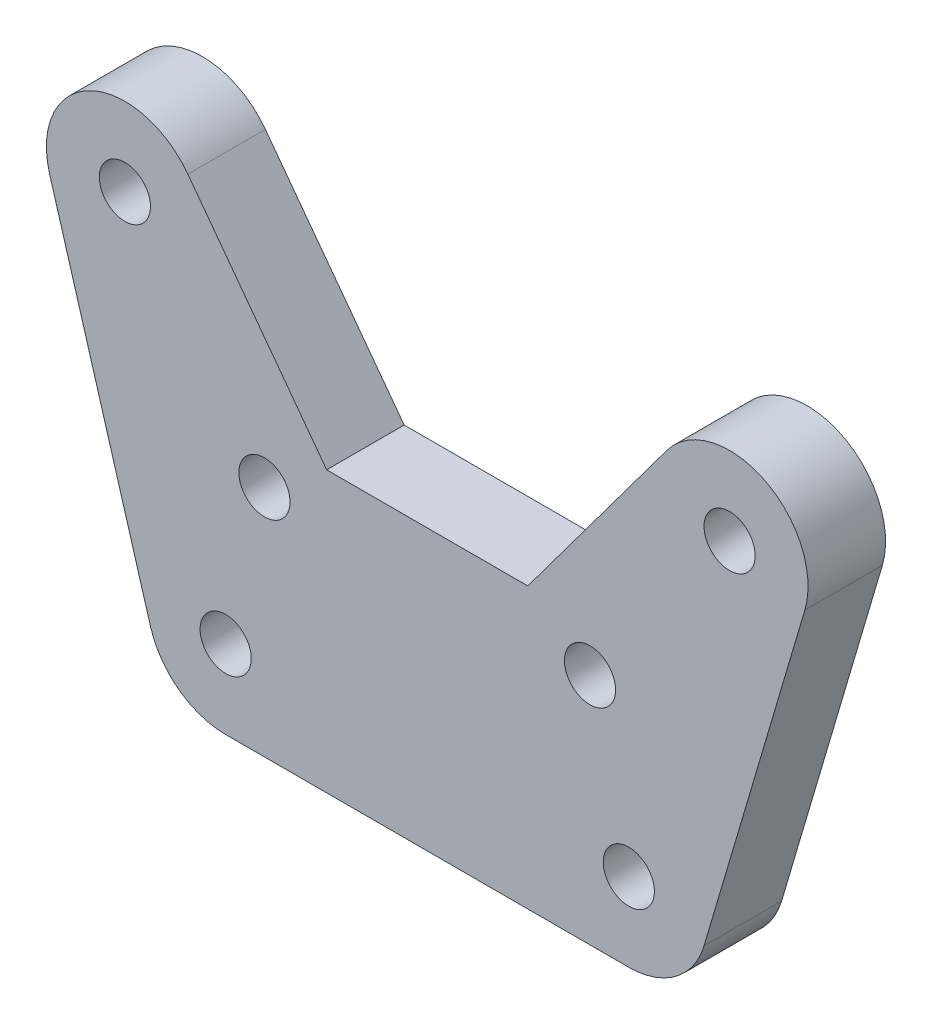
from build123d import *

# Parameters (mm, degrees)
SZKIC1_R                    = 1.65
DODANIE_WYCI_GNI_CIE1_DEPTH = 5


with BuildPart() as part:
    # Szkic1 → Dodanie-wyciągnięcie1 (new body)
    with BuildSketch(Plane.XY):
        with BuildLine():
            Line((17.853722756, -11.434054451), (24.353722756, 10.565945549))
            ThreePointArc((24.353722756, 10.565945549), (21.762078084, 16.527487106), (15.438744243, 15.020155366))
            Line((15.438744243, 15.020155366), (6.487805254, 2.983671115))
            Line((6.487805254, 2.983671115), (-6.487805254, 2.983671115))
            Line((-6.487805254, 2.983671115), (-15.438744243, 15.020155366))
            ThreePointArc((-15.438744243, 15.020155366), (-21.762078084, 16.527487106), (-24.353722756, 10.565945549))
            Line((-24.353722756, 10.565945549), (-17.853722756, -11.434054451))
            ThreePointArc((-17.853722756, -11.434054451), (-16.029619333, -14.054200717), (-13, -15.061139867))
            Line((-13, -15.061139867), (13, -15.061139867))
            ThreePointArc((13, -15.061139867), (16.029619333, -14.054200717), (17.853722756, -11.434054451))
        make_face()
        with Locations((10.5, 0)):
            Circle(SZKIC1_R, mode=Mode.SUBTRACT)
        with Locations((19.5, 12)):
            Circle(SZKIC1_R, mode=Mode.SUBTRACT)
        with Locations((13, -10)):
            Circle(SZKIC1_R, mode=Mode.SUBTRACT)
        with Locations(Location((-13, -10, 0), (0, 0, 180))):
            Circle(SZKIC1_R, mode=Mode.SUBTRACT)
        with Locations(Location((-19.5, 12, 0), (0, 0, 180))):
            Circle(SZKIC1_R, mode=Mode.SUBTRACT)
        with Locations(Location((-10.5, 0, 0), (0, 0, 180))):
            Circle(SZKIC1_R, mode=Mode.SUBTRACT)
    extrude(amount=DODANIE_WYCI_GNI_CIE1_DEPTH)


solid = part.part
